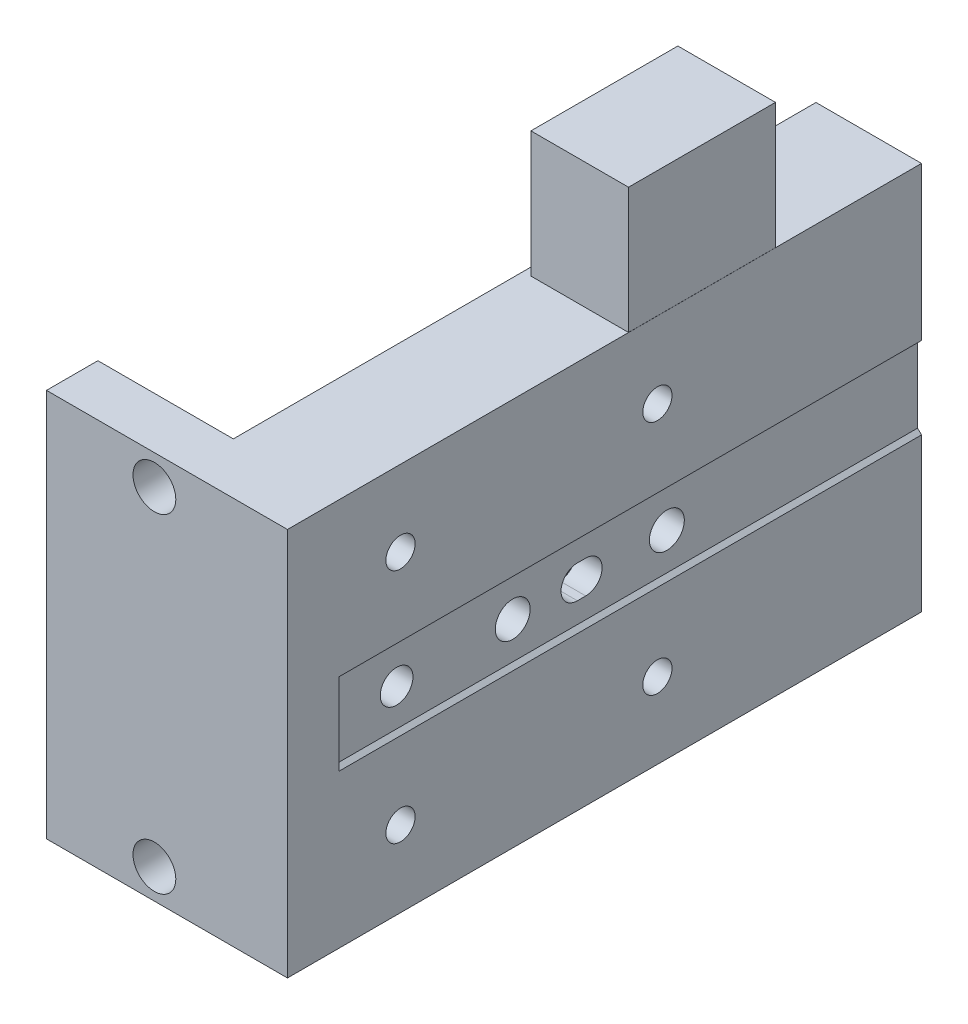
from build123d import *

# Parameters (mm, degrees)
BASE_EXTRUDE_DEPTH              = 5
BOSS_EXTRUDE1_DEPTH             = 56.7
BOSS_EXTRUDE3_DEPTH             = 5
F_3_4_DIAMETER_HOLE1_D          = 3.4
F_4_40_TAPPED_HOLE1_D           = 2.2606
F_4_40_TAPPED_HOLE1_DEPTH       = 8.8646
F_4_40_TAPPED_HOLE1_CBORE_D     = 2.8448
F_4_40_TAPPED_HOLE1_CBORE_DEPTH = 5.6896
F_4_40_TAPPED_HOLE1_TIP         = 0.679152758
F_4_40_TAPPED_HOLE2_D           = 3.4544
F_4_40_TAPPED_HOLE2_CBORE_D     = 4.1656
F_4_40_TAPPED_HOLE2_CBORE_DEPTH = 8.3312
CUT_EXTRUDE1_DEPTH              = 2.54
HOLE1_D                         = 3.1877
HOLE1_DEPTH                     = 2.54
SKETCH14_W                      = 9.5
SKETCH14_H                      = 14.3
BOSS_EXTRUDE2_DEPTH             = 12.24


with BuildPart() as part:
    # Sketch1 → Base-Extrude (new body)
    with BuildSketch(Plane.XY.offset(-942.568622791)):
        Polygon((-5.8406, 18.9), (17.6094, 18.9), (17.6094, 3.98), (17.2294, 3.6), (17.2294, -3.6), (17.6094, -3.98), (17.6094, -18.9), (-5.8406, -18.9), align=None)
    extrude(amount=BASE_EXTRUDE_DEPTH)

    # Sketch3 → Boss-Extrude1 (add)
    with BuildSketch(Plane(origin=(0, 0, -942.568622791), x_dir=(-1, 0, 0), z_dir=(0, 0, -1))):
        Polygon((-17.6094, 3.98), (-17.6094, 18.9), (-7.3406, 18.9), (-7.3406, -18.9), (-17.6094, -18.9), (-17.6094, -3.98), (-17.2294, -3.6), (-17.2294, 3.6), align=None)
    extrude(amount=BOSS_EXTRUDE1_DEPTH)

    # Sketch15 → Boss-Extrude3 (add)
    with BuildSketch(Plane.XY.offset(-937.568622791)):
        Polygon((17.6094, -3.98), (17.2294, -3.6), (17.2294, 3.6), (17.6094, 3.98), align=None)
    extrude(amount=-BOSS_EXTRUDE3_DEPTH)

    # 3.4 Diameter Hole1 (through all)
    with Locations(Plane(origin=(17.2294, 0, 0), x_dir=(0, 0, -1), z_dir=(1, 0, 0))):
        with Locations((959.868622791, 0), (974.868622791, 0)):
            Hole(F_3_4_DIAMETER_HOLE1_D / 2)

    # #4-40 Tapped Hole1
    with Locations(Plane(origin=(17.6094, 0, 0), x_dir=(0, 0, -1), z_dir=(1, 0, 0))):
        with Locations((948.568622791, 11.5), (973.568622791, 11.5), (948.568622791, -11.5), (973.568622791, -11.5)):
            CounterBoreHole(F_4_40_TAPPED_HOLE1_D / 2, F_4_40_TAPPED_HOLE1_CBORE_D / 2, F_4_40_TAPPED_HOLE1_CBORE_DEPTH, depth=F_4_40_TAPPED_HOLE1_DEPTH)
            with Locations((0, 0, -(F_4_40_TAPPED_HOLE1_DEPTH + F_4_40_TAPPED_HOLE1_TIP / 2))):  # 118° drill point
                Cone(0, F_4_40_TAPPED_HOLE1_D / 2, F_4_40_TAPPED_HOLE1_TIP, mode=Mode.SUBTRACT)

    # #4-40 Tapped Hole2 (through all)
    with Locations(Plane.XY.offset(-937.568622791)):
        with Locations((4.6594, 16), (4.6594, -16)):
            CounterBoreHole(F_4_40_TAPPED_HOLE2_D / 2, F_4_40_TAPPED_HOLE2_CBORE_D / 2, F_4_40_TAPPED_HOLE2_CBORE_DEPTH)

    # Sketch11 → Cut-Extrude1 (cut)
    with BuildSketch(Plane(origin=(17.2294, 0, 0), x_dir=(0, 0, -1), z_dir=(1, 0, 0))):
        with BuildLine():
            Line((966.162472791, 1.59385), (966.974772791, 1.59385))
            ThreePointArc((966.974772791, 1.59385), (968.568622791, 0), (966.974772791, -1.59385))
            Line((966.974772791, -1.59385), (966.162472791, -1.59385))
            ThreePointArc((966.162472791, -1.59385), (964.568622791, 0), (966.162472791, 1.59385))
        make_face()
    extrude(amount=-CUT_EXTRUDE1_DEPTH, mode=Mode.SUBTRACT)

    # Hole1
    with Locations(Plane(origin=(17.2294, 0, 0), x_dir=(0, 0, -1), z_dir=(1, 0, 0))):
        with Locations((948.568622791, 0)):
            Hole(HOLE1_D / 2, depth=HOLE1_DEPTH)

    # Sketch14 → Boss-Extrude2 (add)
    with BuildSketch(Plane(origin=(0, 18.9, 0), x_dir=(-1, 0, 0), z_dir=(0, 1, 0))):
        with Locations((-12.8494, -977.918622791)):
            Rectangle(SKETCH14_W, SKETCH14_H)
    extrude(amount=BOSS_EXTRUDE2_DEPTH)


solid = part.part
